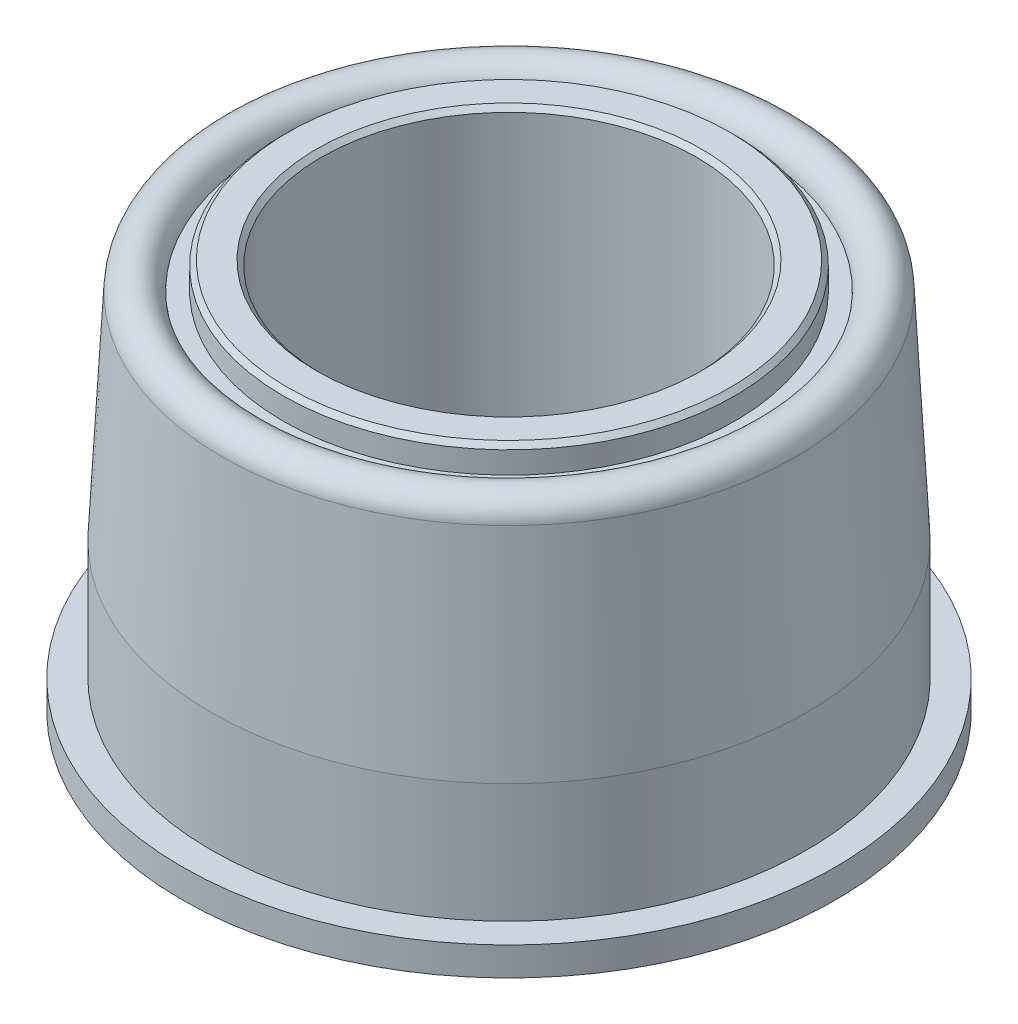
from build123d import *

# Parameters (mm, degrees)
CHAMFER1_SIZE = 0.127


with BuildPart() as part:
    # Sketch1 → Revolve1 (revolve)
    with BuildSketch(Plane.XY, mode=Mode.PRIVATE) as revolve1_sk:
        with BuildLine():
            Line((-8.7122, 0.381), (-8.7122, 1.143))
            Line((-8.7122, 1.143), (-7.9375, 1.143))
            Line((-7.9375, 1.143), (-7.9375, 4.318))
            Line((-7.9375, 4.318), (-7.636387191, 10.063574666))
            ThreePointArc((-7.636387191, 10.063574666), (-7.063125107, 10.61711204), (-6.471000704, 10.0838))
            Line((-6.471000704, 10.0838), (-6.0198, 10.0838))
            Line((-6.0198, 10.0838), (-6.0198, 10.795))
            Line((-6.0198, 10.795), (-5, 10.795))
            Line((-5, 10.795), (-5, 0))
            Line((-5, 0), (-6.0198, 0))
            Line((-6.0198, 0), (-6.0198, 1.651))
            Line((-6.0198, 1.651), (-6.4008, 1.651))
            Line((-6.4008, 1.651), (-6.4008, 0.381))
            Line((-6.4008, 0.381), (-8.7122, 0.381))
        make_face()
    revolve(revolve1_sk.sketch.rotate(Axis((0, 15.281488856, 0), (0, -1, 0)), 270), axis=Axis((0, 15.281488856, 0), (0, -1, 0)))

    # Chamfer1
    chamfer1_edges = [part.edges().sort_by_distance(p)[0] for p in [
        (0, 0, -6.0198),
        (0, 0, -5),
        (0, 10.795, -5),
        (0, 10.795, -6.0198),
        (0, 0.381, -6.4008),
    ]]
    chamfer(chamfer1_edges, length=CHAMFER1_SIZE)


solid = part.part
